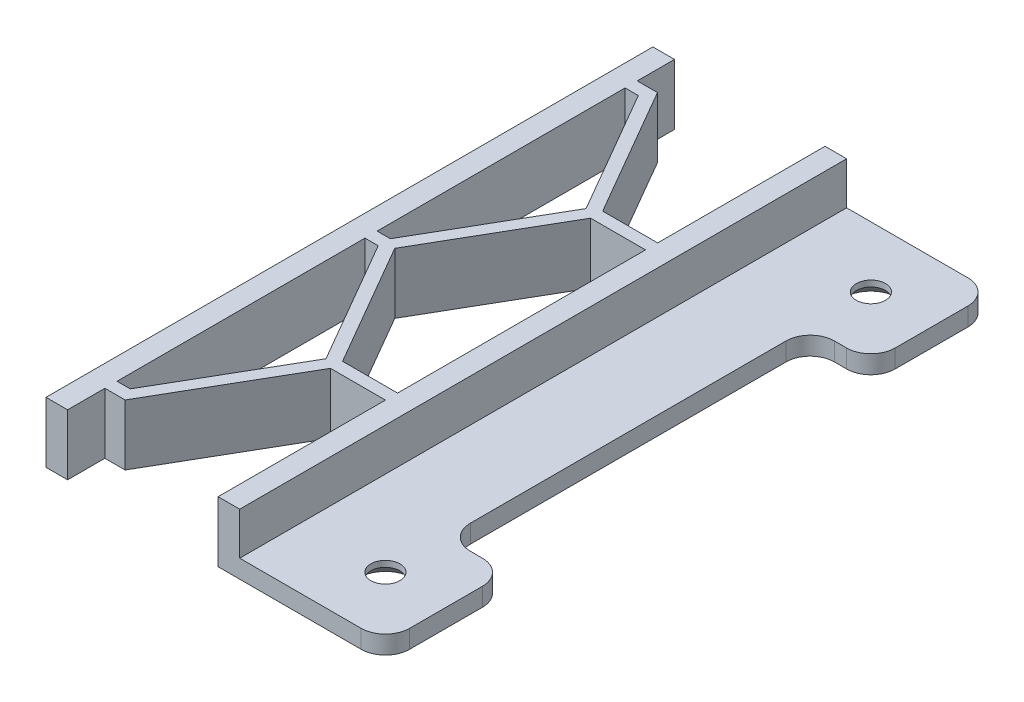
from build123d import *

# Parameters (mm, degrees)
BOSS_EXTRUDE1_DEPTH                            = 5
BOSS_EXTRUDE3_DEPTH                            = 1.5
FILLET1_R                                      = 2
CSK_FOR_M2_FLAT_HEAD_MACHINE_SCREW1_AT_2_COUNT = 2
CSK_FOR_M2_FLAT_HEAD_MACHINE_SCREW1_AT_2_PITCH = 40


with BuildPart() as part:
    # Sketch1 → Boss-Extrude1 (new body)
    with BuildSketch(Plane(origin=(0, 0, 0), x_dir=(1, 0, 0), z_dir=(0, 1, 0))):
        Polygon((-14.18, 46.928571429), (-14.18, 50), (-15.96, 50), (-15.96, 0), (-14.18, 0), (-14.18, 3.071428571), (-12.513875906, 3.071428571), (-6.313875906, 13.785714286), (-1.78, 13.785714286), (-1.78, 0), (0, 0), (0, 50), (-1.78, 50), (-1.78, 36.214285714), (-6.313875906, 36.214285714), (-12.513875906, 46.928571429), align=None)
        Polygon((-14.18, 4.071428571), (-14.18, 24.5), (-13.090568539, 24.5), (-7.179901872, 14.285714286), (-13.090568539, 4.071428571), align=None, mode=Mode.SUBTRACT)
        Polygon((-13.090568539, 45.928571429), (-7.179901872, 35.714285714), (-13.090568539, 25.5), (-14.18, 25.5), (-14.18, 45.928571429), align=None, mode=Mode.SUBTRACT)
        Polygon((-6.313875906, 14.785714286), (-12.224542572, 25), (-6.313875906, 35.214285714), (-1.78, 35.214285714), (-1.78, 14.785714286), align=None, mode=Mode.SUBTRACT)
    extrude(amount=BOSS_EXTRUDE1_DEPTH)

    # Sketch5 → Boss-Extrude3 (add)
    with BuildSketch(Plane.XZ):
        Polygon((12, -40), (12, -50), (0, -50), (0, 0), (12, 0), (12, -10), (7, -10), (7, -40), align=None)
    extrude(amount=-BOSS_EXTRUDE3_DEPTH)

    # Fillet1
    fillet1_edges = [part.edges().sort_by_distance(p)[0] for p in [
        (12, 0.75, 0),
        (12, 0.75, -10),
        (7, 0.75, -10),
        (7, 0.75, -40),
        (12, 0.75, -40),
        (12, 0.75, -50),
    ]]
    fillet(fillet1_edges, radius=FILLET1_R)

    # Sketch6 → CSK for M2 Flat Head Machine Screw1 (revolve, cut)
    with BuildSketch(Plane(origin=(7, 0, -5), x_dir=(0, 0, -1), z_dir=(1, 0, 0))):
        Polygon((0, 0), (0, 1.5), (1.2, 1.5), (1.2, 1), (2.2, 0), align=None)
    csk_for_m2_flat_head_machine_screw1 = revolve(axis=Axis((7, -6.35, -5), (0, 1, 0)), mode=Mode.SUBTRACT)

    # CSK for M2 Flat Head Machine Screw1 at 2: CSK for M2 Flat Head Machine Screw1 ×2
    with Locations(*[(0, 0, -i * CSK_FOR_M2_FLAT_HEAD_MACHINE_SCREW1_AT_2_PITCH) for i in range(1, CSK_FOR_M2_FLAT_HEAD_MACHINE_SCREW1_AT_2_COUNT)]):
        add(csk_for_m2_flat_head_machine_screw1, mode=Mode.SUBTRACT)


solid = part.part
